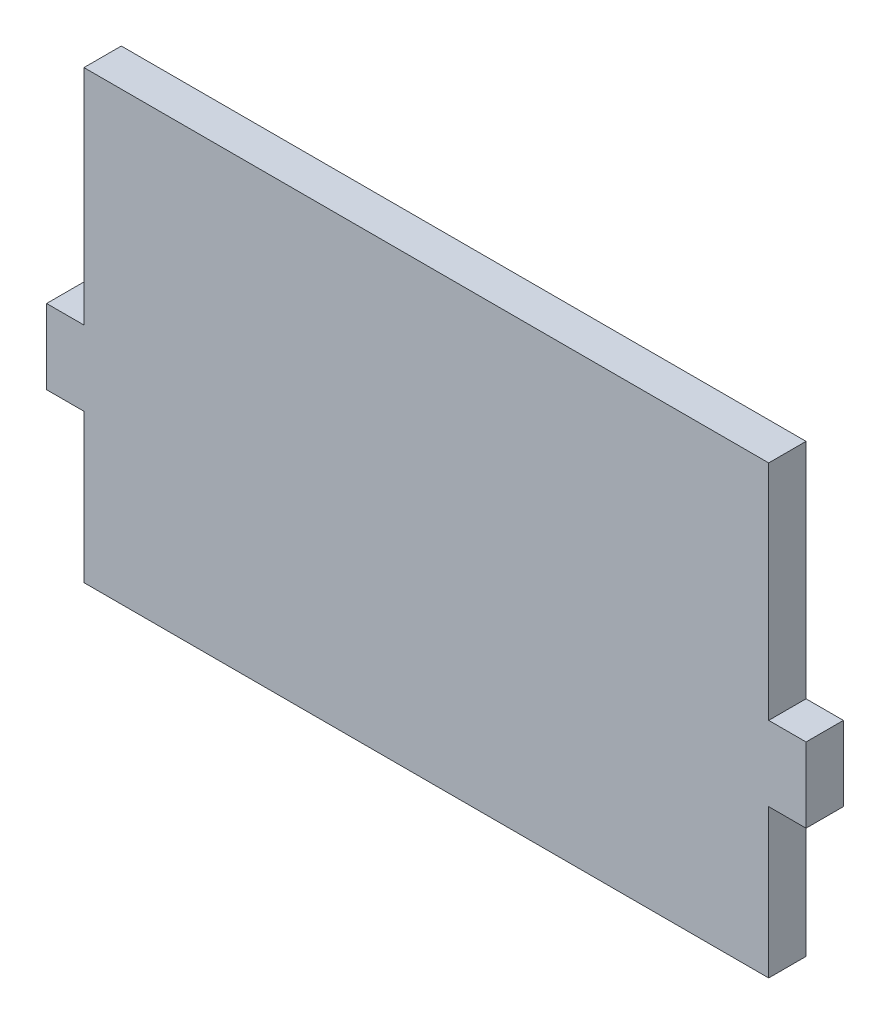
from build123d import *

# Parameters (mm, degrees)
P_IDAT_VYSUNUT_M1_DEPTH = 3


with BuildPart() as part:
    # Skica1 → Přidat vysunutím1 (new body)
    with BuildSketch(Plane.XY):
        Polygon((55, -23.91), (55, -35.83), (0, -35.83), (0, -23.91), (-3, -23.91), (-3, -17.91), (0, -17.91), (0, 0), (55, 0), (55, -17.91), (58, -17.91), (58, -23.91), align=None)
    extrude(amount=P_IDAT_VYSUNUT_M1_DEPTH)


solid = part.part
